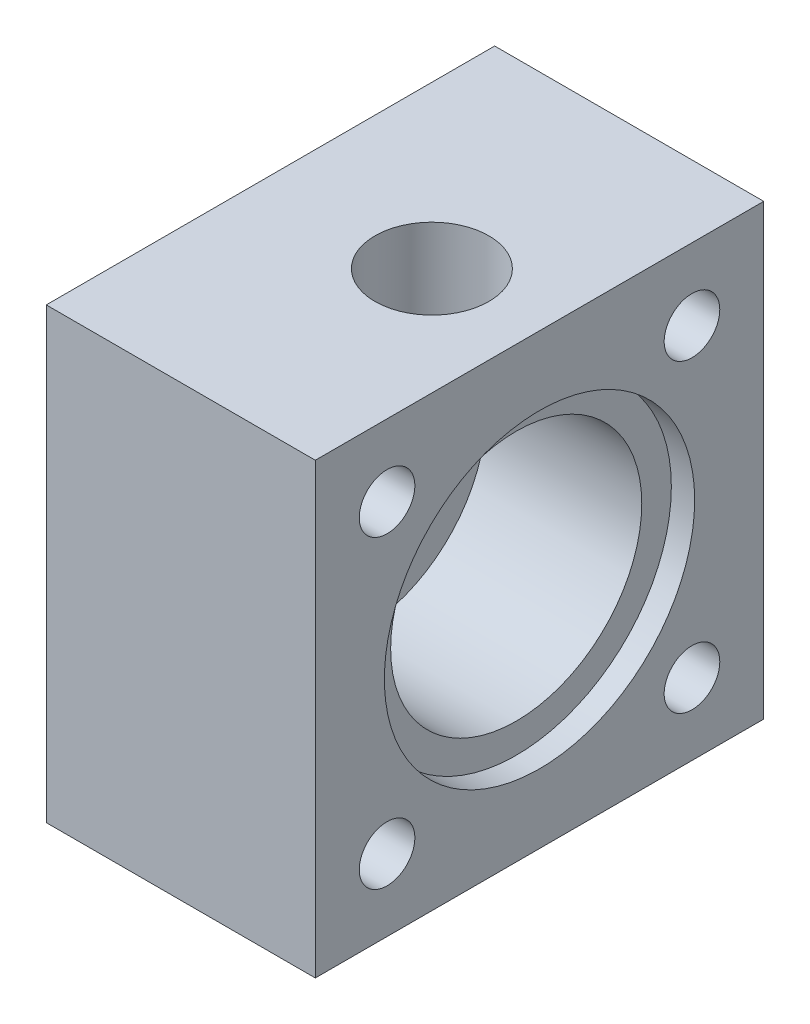
from build123d import *

# Parameters (mm, degrees)
SKETCH1_W          = 25
SKETCH1_H          = 25
SKETCH1_R          = 1.55
EXTRUDE1_DEPTH     = 15
SKETCH2_R          = 7
CUT_EXTRUDE1_DEPTH = 10
SKETCH3_R          = 3.175
CUT_EXTRUDE2_DEPTH = 39.405728739
SKETCH4_R          = 3.175
CUT_EXTRUDE3_DEPTH = 10
SKETCH7_R          = 8.65
CUT_EXTRUDE4_DEPTH = 1.3


with BuildPart() as part:
    # Sketch1 → Extrude1 (new body)
    with BuildSketch(Plane(origin=(0, 0, 0), x_dir=(0, 0, -1), z_dir=(1, 0, 0))):
        with Locations((12.5, 12.5)):
            Rectangle(SKETCH1_W, SKETCH1_H)
        with Locations((4, 4)):
            Circle(SKETCH1_R, mode=Mode.SUBTRACT)
        with Locations((4, 21)):
            Circle(SKETCH1_R, mode=Mode.SUBTRACT)
        with Locations((21, 21)):
            Circle(SKETCH1_R, mode=Mode.SUBTRACT)
        with Locations((21, 4)):
            Circle(SKETCH1_R, mode=Mode.SUBTRACT)
    extrude(amount=-EXTRUDE1_DEPTH)

    # Sketch2 → Cut-Extrude1 (cut)
    with BuildSketch(Plane(origin=(0, 0, 0), x_dir=(0, 0, -1), z_dir=(1, 0, 0))):
        with Locations((12.5, 12.5)):
            Circle(SKETCH2_R)
    extrude(amount=-CUT_EXTRUDE1_DEPTH, mode=Mode.SUBTRACT)

    # Sketch3 → Cut-Extrude2 (cut, through all)
    with BuildSketch(Plane(origin=(0, 0, 0), x_dir=(0, 0, -1), z_dir=(1, 0, 0))):
        with Locations((12.5, 12.5)):
            Circle(SKETCH3_R)
    extrude(amount=-CUT_EXTRUDE2_DEPTH, mode=Mode.SUBTRACT)

    # Sketch4 → Cut-Extrude3 (cut)
    with BuildSketch(Plane(origin=(0, 25, 0), x_dir=(1, 0, 0), z_dir=(0, 1, 0))):
        with Locations(Location((-6, 12.5, 0), (0, 0, 270))):
            Circle(SKETCH4_R)
    extrude(amount=-CUT_EXTRUDE3_DEPTH, mode=Mode.SUBTRACT)

    # Sketch7 → Cut-Extrude4 (cut)
    with BuildSketch(Plane(origin=(0, 0, 0), x_dir=(0, 0, -1), z_dir=(1, 0, 0))):
        with Locations((12.5, 12.5)):
            Circle(SKETCH7_R)
    extrude(amount=-CUT_EXTRUDE4_DEPTH, mode=Mode.SUBTRACT)


solid = part.part
